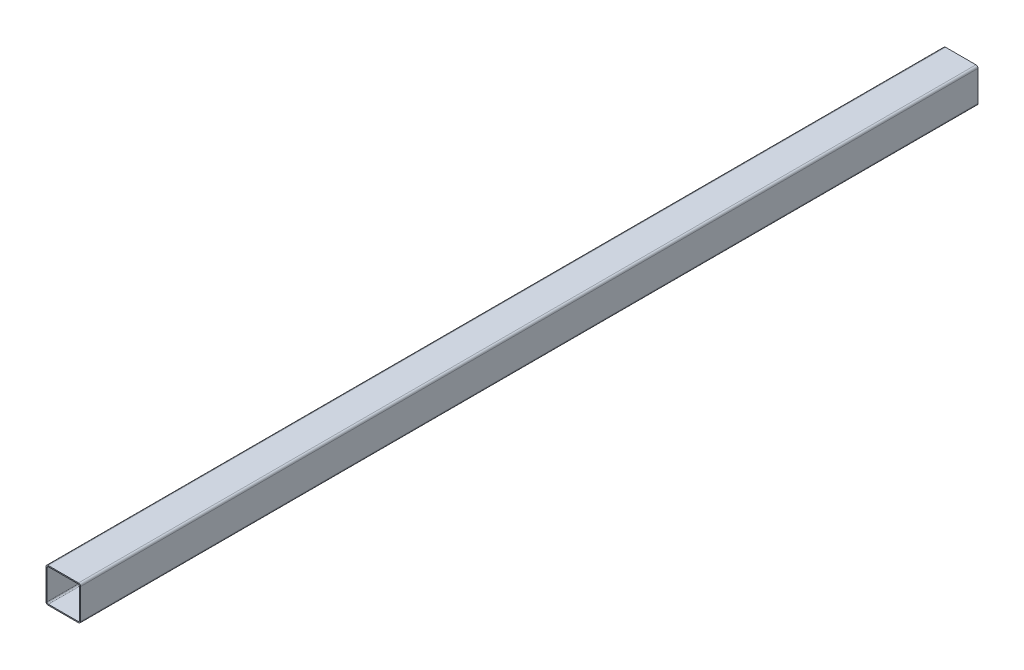
from build123d import *

# Parameters (mm, degrees)
EXTRUDE_1_DEPTH = 2600


with BuildPart() as part:
    # Эскиз1 → Бобышка-Вытянуть1 (new body)
    with BuildSketch(Plane.XY):
        with BuildLine():
            Line((-44, 50), (44, 50))
            ThreePointArc((44, 50), (48.242640687, 48.242640687), (50, 44))
            Line((50, 44), (50, -44))
            ThreePointArc((50, -44), (48.242640687, -48.242640687), (44, -50))
            Line((44, -50), (-44, -50))
            ThreePointArc((-44, -50), (-48.242640687, -48.242640687), (-50, -44))
            Line((-50, -44), (-50, 44))
            ThreePointArc((-50, 44), (-48.242640687, 48.242640687), (-44, 50))
        make_face()
        with BuildLine():
            Line((-43, 47), (43, 47))
            ThreePointArc((43, 47), (45.828427125, 45.828427125), (47, 43))
            Line((47, 43), (47, -43))
            ThreePointArc((47, -43), (45.828427125, -45.828427125), (43, -47))
            Line((43, -47), (-43, -47))
            ThreePointArc((-43, -47), (-45.828427125, -45.828427125), (-47, -43))
            Line((-47, -43), (-47, 43))
            ThreePointArc((-47, 43), (-45.828427125, 45.828427125), (-43, 47))
        make_face(mode=Mode.SUBTRACT)
    extrude(amount=-EXTRUDE_1_DEPTH)


solid = part.part
